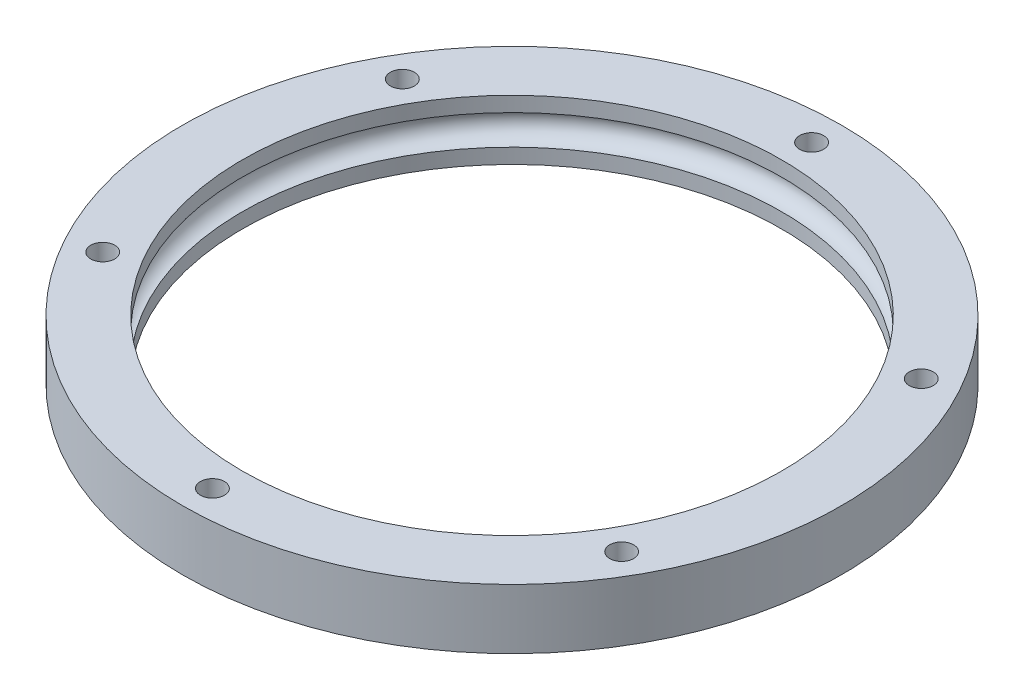
from build123d import *

# Parameters (mm, degrees)
CROQUIS2_R            = 2
CORTAR_EXTRUIR1_DEPTH = 10


with BuildPart() as part:
    # Croquis1 → Revolución1 (revolve)
    with BuildSketch(Plane(origin=(0, 0, 0), x_dir=(0, 0, -1), z_dir=(1, 0, 0))):
        with BuildLine():
            Line((-45, 2.5), (-45, 5))
            Line((-45, 5), (-55, 5))
            Line((-55, 5), (-55, -5))
            Line((-55, -5), (-45, -5))
            Line((-45, -5), (-45, -2.5))
            ThreePointArc((-45, -2.5), (-47.5, 0), (-45, 2.5))
        make_face()
    revolve(axis=Axis((0, 59.07084426, 0), (0, -1, 0)))

    # Croquis2 → Cortar-Extruir1 (cut)
    with BuildSketch(Plane(origin=(0, 5, 0), x_dir=(1, 0, 0), z_dir=(0, 1, 0))):
        with Locations(Location((0, 50, 0), (0, 0, 270))):
            Circle(CROQUIS2_R)
        with Locations(Location((43.301270189, 25, 0), (0, 0, 270))):
            Circle(CROQUIS2_R)
        with Locations(Location((43.301270189, -25, 0), (0, 0, 270))):
            Circle(CROQUIS2_R)
        with Locations(Location((0, -50, 0), (0, 0, 270))):
            Circle(CROQUIS2_R)
        with Locations(Location((-43.301270189, -25, 0), (0, 0, 270))):
            Circle(CROQUIS2_R)
        with Locations(Location((-43.301270189, 25, 0), (0, 0, 270))):
            Circle(CROQUIS2_R)
    extrude(amount=-CORTAR_EXTRUIR1_DEPTH, mode=Mode.SUBTRACT)


solid = part.part
